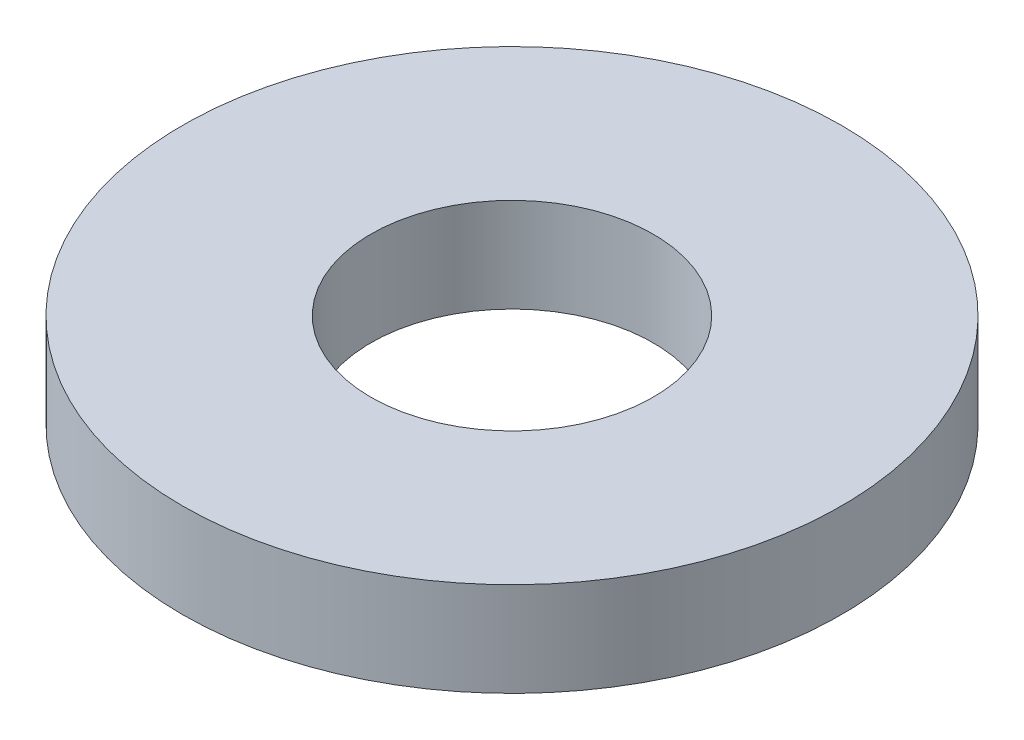
from build123d import *

# Parameters (mm, degrees)
CROQUIS_BASE_R          = 3.5
SALIENTE_EXTRUIR1_DEPTH = 1
CROQUIS_BARRENO_R       = 1.5
CORTAR_EXTRUIR1_DEPTH   = 1


with BuildPart() as part:
    # Croquis base → Saliente-Extruir1 (new body)
    with BuildSketch(Plane(origin=(0, 0, 0), x_dir=(1, 0, 0), z_dir=(0, 1, 0))):
        with Locations(Location((0, 0, 0), (0, 0, 270))):
            Circle(CROQUIS_BASE_R)
    extrude(amount=SALIENTE_EXTRUIR1_DEPTH)

    # Croquis barreno → Cortar-Extruir1 (cut)
    with BuildSketch(Plane(origin=(0, 1, 0), x_dir=(1, 0, 0), z_dir=(0, 1, 0))):
        with Locations(Location((0, 0, 0), (0, 0, 270))):
            Circle(CROQUIS_BARRENO_R)
    extrude(amount=-CORTAR_EXTRUIR1_DEPTH, mode=Mode.SUBTRACT)


solid = part.part
